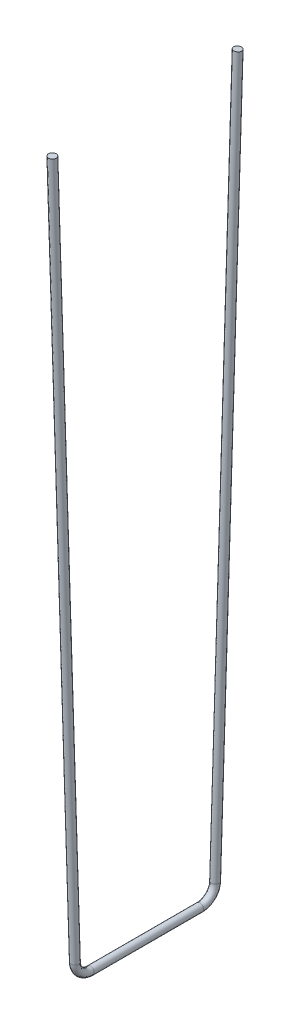
from build123d import *

# Parameters (mm, degrees)
SKETCH1_R = 2.5


with BuildPart() as part:
    # Sweep3: sweep along a path in Sketch2
    with BuildLine(Plane(origin=(0, 0, 0), x_dir=(0, 0, -1), z_dir=(1, 0, 0))) as sweep3_path:
        Line((0, 0), (14.586600746, -459.470427927))
        ThreePointArc((14.586600746, -459.470427927), (17.623586332, -466.33549851), (24.581565334, -469.153122287))
        Line((24.581565334, -469.153122287), (95.418434666, -469.153122287))
        ThreePointArc((95.418434666, -469.153122287), (102.376413668, -466.33549851), (105.413399254, -459.470427927))
        Line((105.413399254, -459.470427927), (120, 0))
    # Sketch1 → Sweep3 (sweep)
    with BuildSketch(Plane(origin=(0, 0, 0), x_dir=(1, 0, 0), z_dir=(0, 1, 0))):
        Circle(SKETCH1_R)
    sweep(path=sweep3_path.line)


solid = part.part
